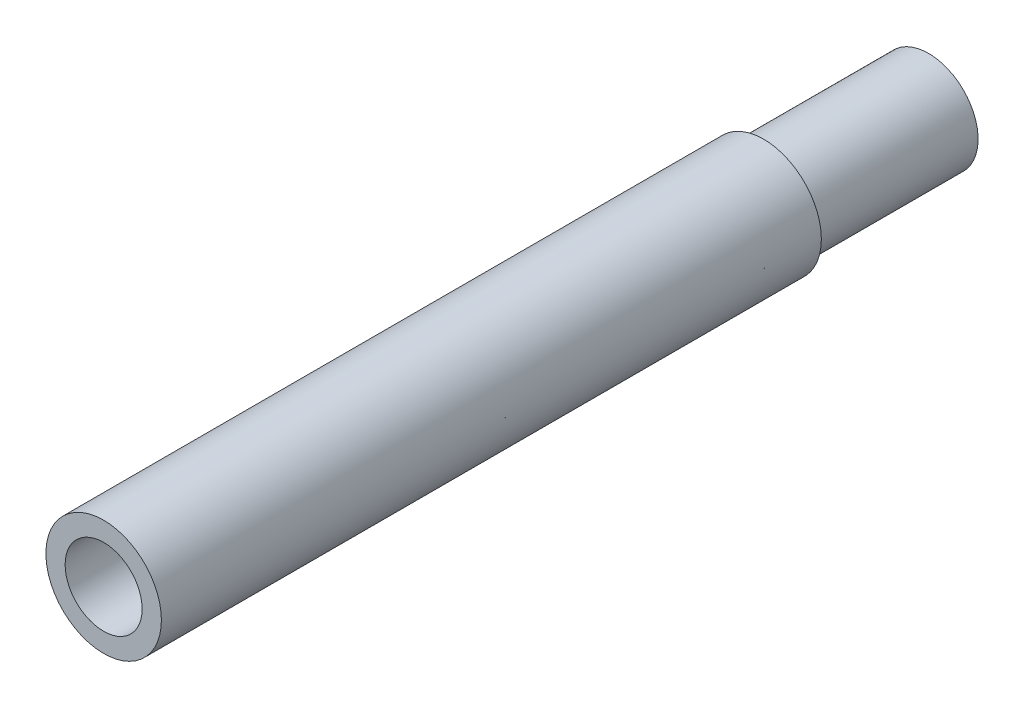
from build123d import *
from build123d.topology import SkipClean

# Parameters (mm, degrees)
SKETCH2_R           = 10.5
SKETCH2_R_2         = 7
BOSS_EXTRUDE1_DEPTH = 120
BOSS_EXTRUDE2_START = 30
SKETCH4_R           = 9
SKETCH4_R_2         = 7
BOSS_EXTRUDE2_DEPTH = 30


with BuildPart() as part:
    # Sketch2 → Boss-Extrude1 (new body)
    with BuildSketch(Plane.XY):
        Circle(SKETCH2_R)
        Circle(SKETCH2_R_2, mode=Mode.SUBTRACT)
    extrude(amount=BOSS_EXTRUDE1_DEPTH)

    # Sketch4 → Boss-Extrude2 (add)
    with SkipClean():  # the faces are left unmerged after this step: merging them gives an invalid solid
        with BuildSketch(Plane(origin=(0, 0, 0), x_dir=(-1, 0, 0), z_dir=(0, 0, -1)).offset(BOSS_EXTRUDE2_START)):
            Circle(SKETCH4_R)
            Circle(SKETCH4_R_2, mode=Mode.SUBTRACT)
        extrude(amount=-BOSS_EXTRUDE2_DEPTH)


solid = part.part
